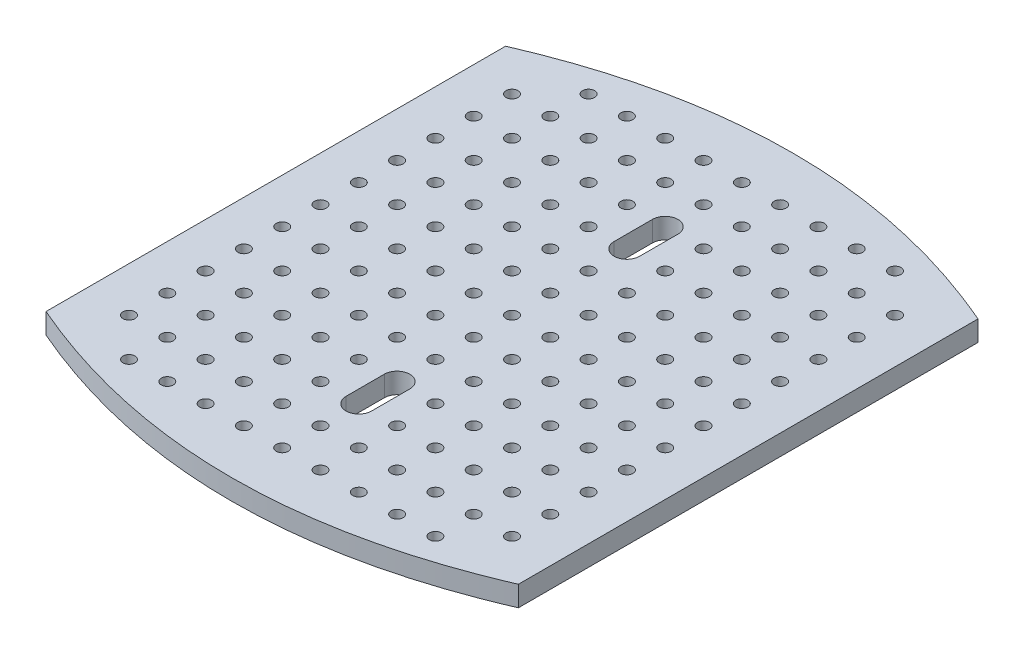
from build123d import *

# Parameters (mm, degrees)
SKETCH2_W               = 185
SKETCH2_H               = 220
BOSS_EXTRUDE1_DEPTH     = 8
CUT_EXTRUDE1_DEPTH      = 144.945302112
CUT_EXTRUDE1_DEPTH_BACK = 8
SKETCH5_R               = 2.35
CUT_EXTRUDE4_DEPTH      = 8
CUT_EXTRUDE6_DEPTH      = 8
SKETCH10_R              = 2.35
BOSS_EXTRUDE2_DEPTH     = 8


with BuildPart() as part:
    # Sketch2 → Boss-Extrude1 (new body)
    with BuildSketch(Plane(origin=(0, 0, 0), x_dir=(1, 0, 0), z_dir=(0, 1, 0))):
        Rectangle(SKETCH2_W, SKETCH2_H)
    extrude(amount=BOSS_EXTRUDE1_DEPTH)

    # Sketch3 → Cut-Extrude1 (cut, two sides: drawn at the far end of the back side and taken through both)
    with BuildSketch(Plane(origin=(0, 0, 0), x_dir=(1, 0, 0), z_dir=(0, 1, 0)).offset(-CUT_EXTRUDE1_DEPTH_BACK)):
        with BuildLine():
            Line((-5.23e-07, 110), (-92.5, 110))
            Line((-92.5, 110), (-92.5, 90))
            add(Edge.make_bspline(
                [(-92.5, 90), (-46.250000261, 109.999999887), (-5.23e-07, 110)],
                knots=[0, 0, 0, 0.499999997, 0.499999997, 0.499999997], degree=2))
        make_face()
        with BuildLine():
            Line((92.5, 110), (-5.23e-07, 110))
            add(Edge.make_bspline(
                [(-5.23e-07, 110), (46.249999739, 110.000000113), (92.5, 90)],
                knots=[0.499999997, 0.499999997, 0.499999997, 1, 1, 1], degree=2))
            Line((92.5, 90), (92.5, 110))
        make_face()
        with BuildLine():
            Line((5.23e-07, -110), (92.5, -110))
            Line((92.5, -110), (92.5, -90))
            add(Edge.make_bspline(
                [(5.23e-07, -110), (46.250000261, -109.999999887), (92.5, -90)],
                knots=[0.500000003, 0.500000003, 0.500000003, 1, 1, 1], degree=2))
        make_face()
        with BuildLine():
            Line((-92.5, -110), (5.23e-07, -110))
            add(Edge.make_bspline(
                [(-92.5, -90), (-46.249999739, -110.000000113), (5.23e-07, -110)],
                knots=[0, 0, 0, 0.500000003, 0.500000003, 0.500000003], degree=2))
            Line((-92.5, -90), (-92.5, -110))
        make_face()
    extrude(amount=CUT_EXTRUDE1_DEPTH + CUT_EXTRUDE1_DEPTH_BACK, mode=Mode.SUBTRACT)

    # Sketch5 → Cut-Extrude4 (cut)
    with BuildSketch(Plane(origin=(0, 0, 0), x_dir=(1, 0, 0), z_dir=(0, 1, 0))):
        with Locations(Location((-75, -90, 0), (0, 0, 270))):
            Circle(SKETCH5_R)
        with Locations(Location((-60, -90, 0), (0, 0, 270))):
            Circle(SKETCH5_R)
        with Locations(Location((-45, -90, 0), (0, 0, 270))):
            Circle(SKETCH5_R)
        with Locations(Location((-30, -90, 0), (0, 0, 270))):
            Circle(SKETCH5_R)
        with Locations(Location((-15, -90, 0), (0, 0, 270))):
            Circle(SKETCH5_R)
        with Locations(Location((0, -90, 0), (0, 0, 270))):
            Circle(SKETCH5_R)
        with Locations(Location((15, -90, 0), (0, 0, 270))):
            Circle(SKETCH5_R)
        with Locations(Location((30, -90, 0), (0, 0, 270))):
            Circle(SKETCH5_R)
        with Locations(Location((45, -90, 0), (0, 0, 270))):
            Circle(SKETCH5_R)
        with Locations(Location((60, -90, 0), (0, 0, 270))):
            Circle(SKETCH5_R)
        with Locations(Location((-60, -75, 0), (0, 0, 270))):
            Circle(SKETCH5_R)
        with Locations(Location((-45, -75, 0), (0, 0, 270))):
            Circle(SKETCH5_R)
        with Locations(Location((-30, -75, 0), (0, 0, 270))):
            Circle(SKETCH5_R)
        with Locations(Location((-15, -75, 0), (0, 0, 270))):
            Circle(SKETCH5_R)
        with Locations(Location((0, -75, 0), (0, 0, 270))):
            Circle(SKETCH5_R)
        with Locations(Location((15, -75, 0), (0, 0, 270))):
            Circle(SKETCH5_R)
        with Locations(Location((30, -75, 0), (0, 0, 270))):
            Circle(SKETCH5_R)
        with Locations(Location((45, -75, 0), (0, 0, 270))):
            Circle(SKETCH5_R)
        with Locations(Location((60, -75, 0), (0, 0, 270))):
            Circle(SKETCH5_R)
        with Locations(Location((75, -75, 0), (0, 0, 270))):
            Circle(SKETCH5_R)
        with Locations(Location((-60, -60, 0), (0, 0, 270))):
            Circle(SKETCH5_R)
        with Locations(Location((-45, -60, 0), (0, 0, 270))):
            Circle(SKETCH5_R)
        with Locations(Location((-30, -60, 0), (0, 0, 270))):
            Circle(SKETCH5_R)
        with Locations(Location((-15, -60, 0), (0, 0, 270))):
            Circle(SKETCH5_R)
        with Locations(Location((0, -60, 0), (0, 0, 270))):
            Circle(SKETCH5_R)
        with Locations(Location((15, -60, 0), (0, 0, 270))):
            Circle(SKETCH5_R)
        with Locations(Location((30, -60, 0), (0, 0, 270))):
            Circle(SKETCH5_R)
        with Locations(Location((45, -60, 0), (0, 0, 270))):
            Circle(SKETCH5_R)
        with Locations(Location((60, -60, 0), (0, 0, 270))):
            Circle(SKETCH5_R)
        with Locations(Location((75, -60, 0), (0, 0, 270))):
            Circle(SKETCH5_R)
        with Locations(Location((-60, -45, 0), (0, 0, 270))):
            Circle(SKETCH5_R)
        with Locations(Location((-45, -45, 0), (0, 0, 270))):
            Circle(SKETCH5_R)
        with Locations(Location((-30, -45, 0), (0, 0, 270))):
            Circle(SKETCH5_R)
        with Locations(Location((-15, -45, 0), (0, 0, 270))):
            Circle(SKETCH5_R)
        with Locations(Location((0, -45, 0), (0, 0, 270))):
            Circle(SKETCH5_R)
        with Locations(Location((15, -45, 0), (0, 0, 270))):
            Circle(SKETCH5_R)
        with Locations(Location((30, -45, 0), (0, 0, 270))):
            Circle(SKETCH5_R)
        with Locations(Location((45, -45, 0), (0, 0, 270))):
            Circle(SKETCH5_R)
        with Locations(Location((60, -45, 0), (0, 0, 270))):
            Circle(SKETCH5_R)
        with Locations(Location((75, -45, 0), (0, 0, 270))):
            Circle(SKETCH5_R)
        with Locations(Location((-60, -30, 0), (0, 0, 270))):
            Circle(SKETCH5_R)
        with Locations(Location((-45, -30, 0), (0, 0, 270))):
            Circle(SKETCH5_R)
        with Locations(Location((-30, -30, 0), (0, 0, 270))):
            Circle(SKETCH5_R)
        with Locations(Location((-15, -30, 0), (0, 0, 270))):
            Circle(SKETCH5_R)
        with Locations(Location((0, -30, 0), (0, 0, 270))):
            Circle(SKETCH5_R)
        with Locations(Location((15, -30, 0), (0, 0, 270))):
            Circle(SKETCH5_R)
        with Locations(Location((30, -30, 0), (0, 0, 270))):
            Circle(SKETCH5_R)
        with Locations(Location((45, -30, 0), (0, 0, 270))):
            Circle(SKETCH5_R)
        with Locations(Location((60, -30, 0), (0, 0, 270))):
            Circle(SKETCH5_R)
        with Locations(Location((75, -30, 0), (0, 0, 270))):
            Circle(SKETCH5_R)
        with Locations(Location((-60, -15, 0), (0, 0, 270))):
            Circle(SKETCH5_R)
        with Locations(Location((-45, -15, 0), (0, 0, 270))):
            Circle(SKETCH5_R)
        with Locations(Location((-30, -15, 0), (0, 0, 270))):
            Circle(SKETCH5_R)
        with Locations(Location((-15, -15, 0), (0, 0, 270))):
            Circle(SKETCH5_R)
        with Locations(Location((0, -15, 0), (0, 0, 270))):
            Circle(SKETCH5_R)
        with Locations(Location((15, -15, 0), (0, 0, 270))):
            Circle(SKETCH5_R)
        with Locations(Location((30, -15, 0), (0, 0, 270))):
            Circle(SKETCH5_R)
        with Locations(Location((45, -15, 0), (0, 0, 270))):
            Circle(SKETCH5_R)
        with Locations(Location((60, -15, 0), (0, 0, 270))):
            Circle(SKETCH5_R)
        with Locations(Location((75, -15, 0), (0, 0, 270))):
            Circle(SKETCH5_R)
        with Locations(Location((-60, 0, 0), (0, 0, 270))):
            Circle(SKETCH5_R)
        with Locations(Location((-45, 0, 0), (0, 0, 270))):
            Circle(SKETCH5_R)
        with Locations(Location((-30, 0, 0), (0, 0, 270))):
            Circle(SKETCH5_R)
        with Locations(Location((-15, 0, 0), (0, 0, 270))):
            Circle(SKETCH5_R)
        with Locations(Location((0, 0, 0), (0, 0, 270))):
            Circle(SKETCH5_R)
        with Locations(Location((15, 0, 0), (0, 0, 270))):
            Circle(SKETCH5_R)
        with Locations(Location((30, 0, 0), (0, 0, 270))):
            Circle(SKETCH5_R)
        with Locations(Location((45, 0, 0), (0, 0, 270))):
            Circle(SKETCH5_R)
        with Locations(Location((60, 0, 0), (0, 0, 270))):
            Circle(SKETCH5_R)
        with Locations(Location((75, 0, 0), (0, 0, 270))):
            Circle(SKETCH5_R)
        with Locations(Location((-60, 15, 0), (0, 0, 270))):
            Circle(SKETCH5_R)
        with Locations(Location((-45, 15, 0), (0, 0, 270))):
            Circle(SKETCH5_R)
        with Locations(Location((-30, 15, 0), (0, 0, 270))):
            Circle(SKETCH5_R)
        with Locations(Location((-15, 15, 0), (0, 0, 270))):
            Circle(SKETCH5_R)
        with Locations(Location((0, 15, 0), (0, 0, 270))):
            Circle(SKETCH5_R)
        with Locations(Location((15, 15, 0), (0, 0, 270))):
            Circle(SKETCH5_R)
        with Locations(Location((30, 15, 0), (0, 0, 270))):
            Circle(SKETCH5_R)
        with Locations(Location((45, 15, 0), (0, 0, 270))):
            Circle(SKETCH5_R)
        with Locations(Location((60, 15, 0), (0, 0, 270))):
            Circle(SKETCH5_R)
        with Locations(Location((75, 15, 0), (0, 0, 270))):
            Circle(SKETCH5_R)
        with Locations(Location((-60, 30, 0), (0, 0, 270))):
            Circle(SKETCH5_R)
        with Locations(Location((-45, 30, 0), (0, 0, 270))):
            Circle(SKETCH5_R)
        with Locations(Location((-30, 30, 0), (0, 0, 270))):
            Circle(SKETCH5_R)
        with Locations(Location((-15, 30, 0), (0, 0, 270))):
            Circle(SKETCH5_R)
        with Locations(Location((0, 30, 0), (0, 0, 270))):
            Circle(SKETCH5_R)
        with Locations(Location((15, 30, 0), (0, 0, 270))):
            Circle(SKETCH5_R)
        with Locations(Location((30, 30, 0), (0, 0, 270))):
            Circle(SKETCH5_R)
        with Locations(Location((45, 30, 0), (0, 0, 270))):
            Circle(SKETCH5_R)
        with Locations(Location((60, 30, 0), (0, 0, 270))):
            Circle(SKETCH5_R)
        with Locations(Location((75, 30, 0), (0, 0, 270))):
            Circle(SKETCH5_R)
        with Locations(Location((-60, 45, 0), (0, 0, 270))):
            Circle(SKETCH5_R)
        with Locations(Location((-45, 45, 0), (0, 0, 270))):
            Circle(SKETCH5_R)
        with Locations(Location((-30, 45, 0), (0, 0, 270))):
            Circle(SKETCH5_R)
        with Locations(Location((-15, 45, 0), (0, 0, 270))):
            Circle(SKETCH5_R)
        with Locations(Location((0, 45, 0), (0, 0, 270))):
            Circle(SKETCH5_R)
        with Locations(Location((15, 45, 0), (0, 0, 270))):
            Circle(SKETCH5_R)
        with Locations(Location((30, 45, 0), (0, 0, 270))):
            Circle(SKETCH5_R)
        with Locations(Location((45, 45, 0), (0, 0, 270))):
            Circle(SKETCH5_R)
        with Locations(Location((60, 45, 0), (0, 0, 270))):
            Circle(SKETCH5_R)
        with Locations(Location((75, 45, 0), (0, 0, 270))):
            Circle(SKETCH5_R)
        with Locations(Location((-60, 60, 0), (0, 0, 270))):
            Circle(SKETCH5_R)
        with Locations(Location((-45, 60, 0), (0, 0, 270))):
            Circle(SKETCH5_R)
        with Locations(Location((-30, 60, 0), (0, 0, 270))):
            Circle(SKETCH5_R)
        with Locations(Location((-15, 60, 0), (0, 0, 270))):
            Circle(SKETCH5_R)
        with Locations(Location((0, 60, 0), (0, 0, 270))):
            Circle(SKETCH5_R)
        with Locations(Location((15, 60, 0), (0, 0, 270))):
            Circle(SKETCH5_R)
        with Locations(Location((30, 60, 0), (0, 0, 270))):
            Circle(SKETCH5_R)
        with Locations(Location((45, 60, 0), (0, 0, 270))):
            Circle(SKETCH5_R)
        with Locations(Location((60, 60, 0), (0, 0, 270))):
            Circle(SKETCH5_R)
        with Locations(Location((75, 60, 0), (0, 0, 270))):
            Circle(SKETCH5_R)
        with Locations(Location((-60, 75, 0), (0, 0, 270))):
            Circle(SKETCH5_R)
        with Locations(Location((-45, 75, 0), (0, 0, 270))):
            Circle(SKETCH5_R)
        with Locations(Location((-30, 75, 0), (0, 0, 270))):
            Circle(SKETCH5_R)
        with Locations(Location((-15, 75, 0), (0, 0, 270))):
            Circle(SKETCH5_R)
        with Locations(Location((0, 75, 0), (0, 0, 270))):
            Circle(SKETCH5_R)
        with Locations(Location((15, 75, 0), (0, 0, 270))):
            Circle(SKETCH5_R)
        with Locations(Location((30, 75, 0), (0, 0, 270))):
            Circle(SKETCH5_R)
        with Locations(Location((45, 75, 0), (0, 0, 270))):
            Circle(SKETCH5_R)
        with Locations(Location((60, 75, 0), (0, 0, 270))):
            Circle(SKETCH5_R)
        with Locations(Location((75, 75, 0), (0, 0, 270))):
            Circle(SKETCH5_R)
        with Locations(Location((-60, 90, 0), (0, 0, 270))):
            Circle(SKETCH5_R)
        with Locations(Location((-45, 90, 0), (0, 0, 270))):
            Circle(SKETCH5_R)
        with Locations(Location((-30, 90, 0), (0, 0, 270))):
            Circle(SKETCH5_R)
        with Locations(Location((-15, 90, 0), (0, 0, 270))):
            Circle(SKETCH5_R)
        with Locations(Location((0, 90, 0), (0, 0, 270))):
            Circle(SKETCH5_R)
        with Locations(Location((15, 90, 0), (0, 0, 270))):
            Circle(SKETCH5_R)
        with Locations(Location((30, 90, 0), (0, 0, 270))):
            Circle(SKETCH5_R)
        with Locations(Location((45, 90, 0), (0, 0, 270))):
            Circle(SKETCH5_R)
        with Locations(Location((60, 90, 0), (0, 0, 270))):
            Circle(SKETCH5_R)
        with Locations(Location((-75, -75, 0), (0, 0, 270))):
            Circle(SKETCH5_R)
        with Locations(Location((-75, -60, 0), (0, 0, 270))):
            Circle(SKETCH5_R)
        with Locations(Location((-75, -45, 0), (0, 0, 270))):
            Circle(SKETCH5_R)
        with Locations(Location((-75, -30, 0), (0, 0, 270))):
            Circle(SKETCH5_R)
        with Locations(Location((-75, -15, 0), (0, 0, 270))):
            Circle(SKETCH5_R)
        with Locations(Location((-75, 0, 0), (0, 0, 270))):
            Circle(SKETCH5_R)
        with Locations(Location((-75, 15, 0), (0, 0, 270))):
            Circle(SKETCH5_R)
        with Locations(Location((-75, 30, 0), (0, 0, 270))):
            Circle(SKETCH5_R)
        with Locations(Location((-75, 45, 0), (0, 0, 270))):
            Circle(SKETCH5_R)
        with Locations(Location((-75, 60, 0), (0, 0, 270))):
            Circle(SKETCH5_R)
        with Locations(Location((-75, 75, 0), (0, 0, 270))):
            Circle(SKETCH5_R)
    extrude(amount=CUT_EXTRUDE4_DEPTH, mode=Mode.SUBTRACT)

    # Sketch8 → Cut-Extrude6 (cut)
    with BuildSketch(Plane(origin=(0, 0, 0), x_dir=(1, 0, 0), z_dir=(0, 1, 0))):
        with BuildLine():
            Line((5, 60), (5, 45))
            ThreePointArc((5, 45), (0, 40), (-5, 45))
            Line((-5, 45), (-5, 60))
            ThreePointArc((-5, 60), (0, 65), (5, 60))
        make_face()
        with BuildLine():
            Line((5, -60), (5, -45))
            ThreePointArc((5, -45), (0, -40), (-5, -45))
            Line((-5, -45), (-5, -60))
            ThreePointArc((-5, -60), (0, -65), (5, -60))
        make_face()
    extrude(amount=CUT_EXTRUDE6_DEPTH, mode=Mode.SUBTRACT)


with BuildPart() as body_2:
    # Sketch10 → Boss-Extrude2 (new body)
    with BuildSketch(Plane(origin=(0, 0, 0), x_dir=(1, 0, 0), z_dir=(0, 1, 0))):
        with Locations(Location((-75, -90, 0), (0, 0, 270))):
            Circle(SKETCH10_R)
    extrude(amount=BOSS_EXTRUDE2_DEPTH)

    # Combine1: union part
    add(part.part)


solid = body_2.part
